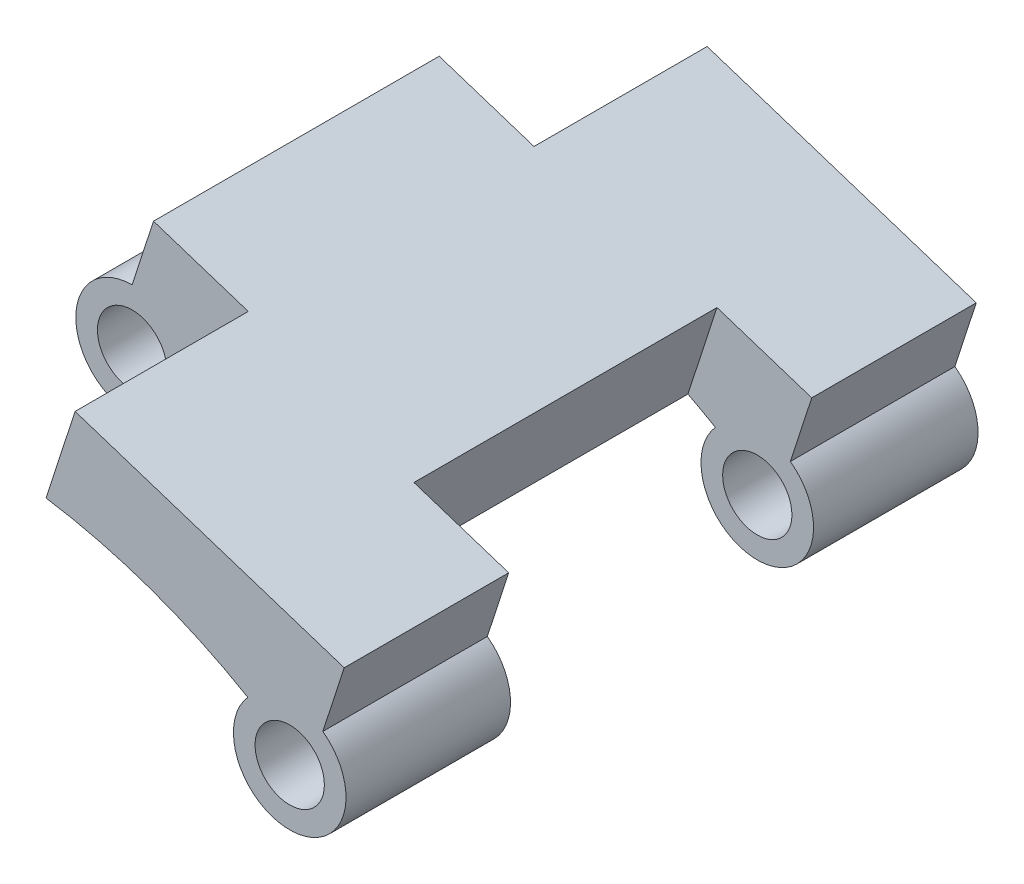
from build123d import *

# Parameters (mm, degrees)
SALIENTE_EXTRUIR1_DEPTH      = 6.5
SALIENTE_EXTRUIR1_DEPTH_BACK = 30
CROQUIS1_R                   = 2
CROQUIS2_W                   = 8
CROQUIS2_H                   = 10
CROQUIS2_H_2                 = 17.5
CORTAR_EXTRUIR2_DEPTH        = 20


with BuildPart() as part:
    # Croquis1 → Saliente-Extruir1 (new, two sides: drawn at the far end of the back side and taken through both)
    with BuildSketch(Plane.XY.offset(-SALIENTE_EXTRUIR1_DEPTH_BACK)):
        with BuildLine():
            Line((28.793175074, 33.764978898), (7.779852304, 40.592621349))
            Line((7.779852304, 40.592621349), (6.543784327, 36.788395284))
            ThreePointArc((6.543784327, 36.788395284), (4.366334456, 31.125676473), (9.776753104, 33.870679629))
            ThreePointArc((9.776753104, 33.870679629), (16.738586943, 32.414771462), (23.226590181, 29.500562652))
            ThreePointArc((23.226590181, 29.500562652), (25.990238441, 24.099644159), (27.557107096, 29.960752833))
            Line((27.557107096, 29.960752833), (28.793175074, 33.764978898))
        make_face()
        with Locations((6.543784327, 33.538395284)):
            Circle(CROQUIS1_R, mode=Mode.SUBTRACT)
        with Locations((25.646805026, 27.331447601)):
            Circle(CROQUIS1_R, mode=Mode.SUBTRACT)
    extrude(amount=SALIENTE_EXTRUIR1_DEPTH + SALIENTE_EXTRUIR1_DEPTH_BACK)

    # Croquis2 → Cortar-Extruir2 (cut)
    with BuildSketch(Plane(origin=(12.672781879, 39.002812158, 0), x_dir=(0.9510565162951536, -0.3090169943749473, 0), z_dir=(0.3090169943749473, 0.9510565162951536, 0))):
        with Locations((-3.390425382, 25)):
            Rectangle(CROQUIS2_W, CROQUIS2_H)
        with Locations((-3.390425382, -1.5)):
            Rectangle(CROQUIS2_W, CROQUIS2_H)
        with Locations((15.195679253, 11.75)):
            Rectangle(CROQUIS2_W, CROQUIS2_H_2)
    extrude(amount=-CORTAR_EXTRUIR2_DEPTH, mode=Mode.SUBTRACT)


solid = part.part
